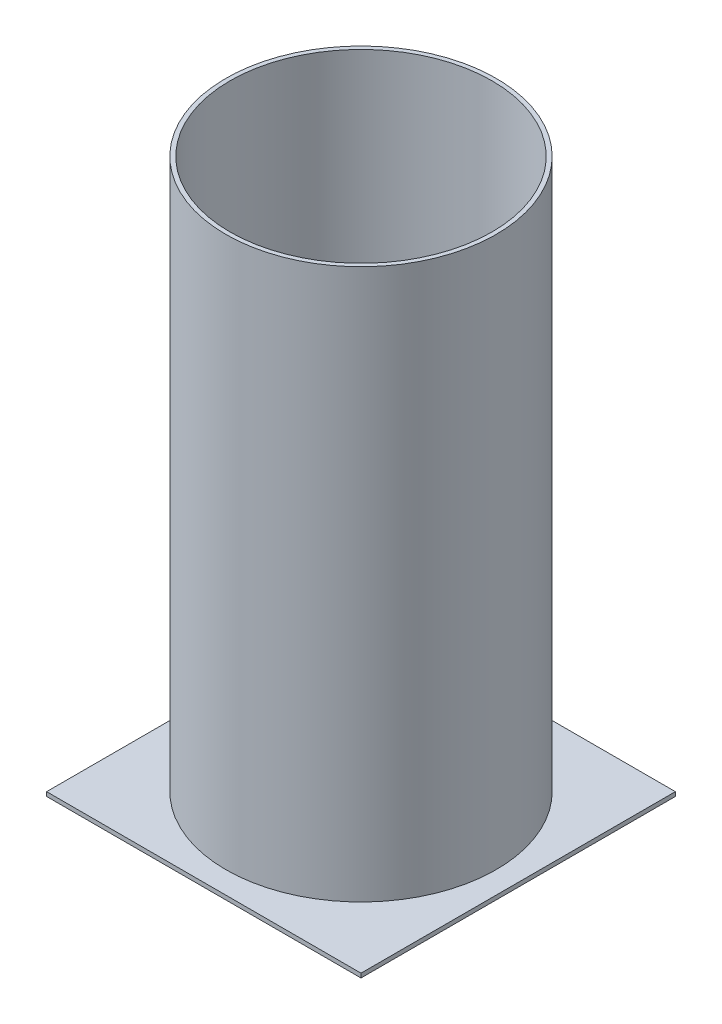
from build123d import *

# Parameters (mm, degrees)
SKETCH1_W           = 300
SKETCH1_H           = 300
BOSS_EXTRUDE2_DEPTH = 4
SKETCH2_R           = 129
SKETCH2_R_2         = 125
BOSS_EXTRUDE3_DEPTH = 525


with BuildPart() as part:
    # Sketch1 → Boss-Extrude2 (new body)
    with BuildSketch(Plane(origin=(0, 0, 0), x_dir=(1, 0, 0), z_dir=(0, 1, 0))):
        with Locations((150, 150)):
            Rectangle(SKETCH1_W, SKETCH1_H)
    extrude(amount=BOSS_EXTRUDE2_DEPTH)

    # Sketch2 → Boss-Extrude3 (add)
    with BuildSketch(Plane(origin=(0, 4, 0), x_dir=(1, 0, 0), z_dir=(0, 1, 0))):
        with Locations(Location((150, 150, 0), (0, 0, 270))):
            Circle(SKETCH2_R)
        with Locations(Location((150, 150, 0), (0, 0, 270))):
            Circle(SKETCH2_R_2, mode=Mode.SUBTRACT)
    extrude(amount=BOSS_EXTRUDE3_DEPTH)


solid = part.part
